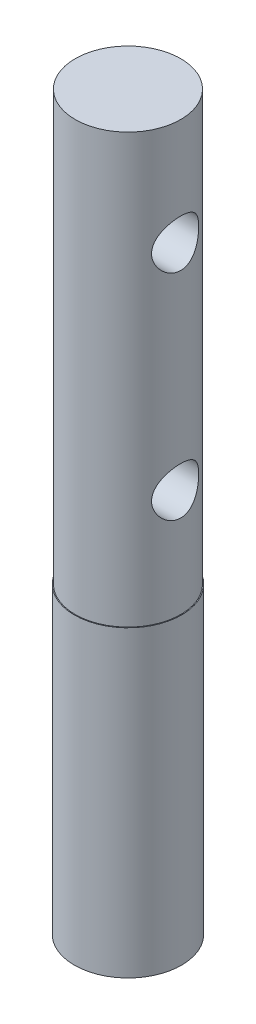
from build123d import *

# Parameters (mm, degrees)
SKETCH1_R               = 25
BOSS_EXTRUDE1_DEPTH     = 141.5
SKETCH2_R               = 24.61
BOSS_EXTRUDE2_DEPTH     = 200
CUT_EXTRUDE1_DEPTH      = 344.325283077
CUT_EXTRUDE1_DEPTH_BACK = 344.325283077
SKETCH3_R               = 11


with BuildPart() as part:
    # Sketch1 → Boss-Extrude1 (new body)
    with BuildSketch(Plane(origin=(0, 0, 0), x_dir=(1, 0, 0), z_dir=(0, 1, 0))):
        with Locations(Location((0, 0, 0), (0, 0, 270))):
            Circle(SKETCH1_R)
    extrude(amount=BOSS_EXTRUDE1_DEPTH)

    # Sketch2 → Boss-Extrude2 (add)
    with BuildSketch(Plane(origin=(0, 141.5, 0), x_dir=(1, 0, 0), z_dir=(0, 1, 0))):
        with Locations(Location((0, 0, 0), (0, 0, 270))):
            Circle(SKETCH2_R)
    extrude(amount=BOSS_EXTRUDE2_DEPTH)

    # Sketch3 → Cut-Extrude1 (cut, two sides: drawn at the far end of the back side and taken through both)
    with BuildSketch(Plane(origin=(0, 0, 0), x_dir=(0, 0, -1), z_dir=(1, 0, 0)).offset(-CUT_EXTRUDE1_DEPTH_BACK)):
        with Locations((0, 191.5)):
            Circle(SKETCH3_R)
        with Locations((0, 291.5)):
            Circle(SKETCH3_R)
    extrude(amount=CUT_EXTRUDE1_DEPTH + CUT_EXTRUDE1_DEPTH_BACK, mode=Mode.SUBTRACT)


solid = part.part
